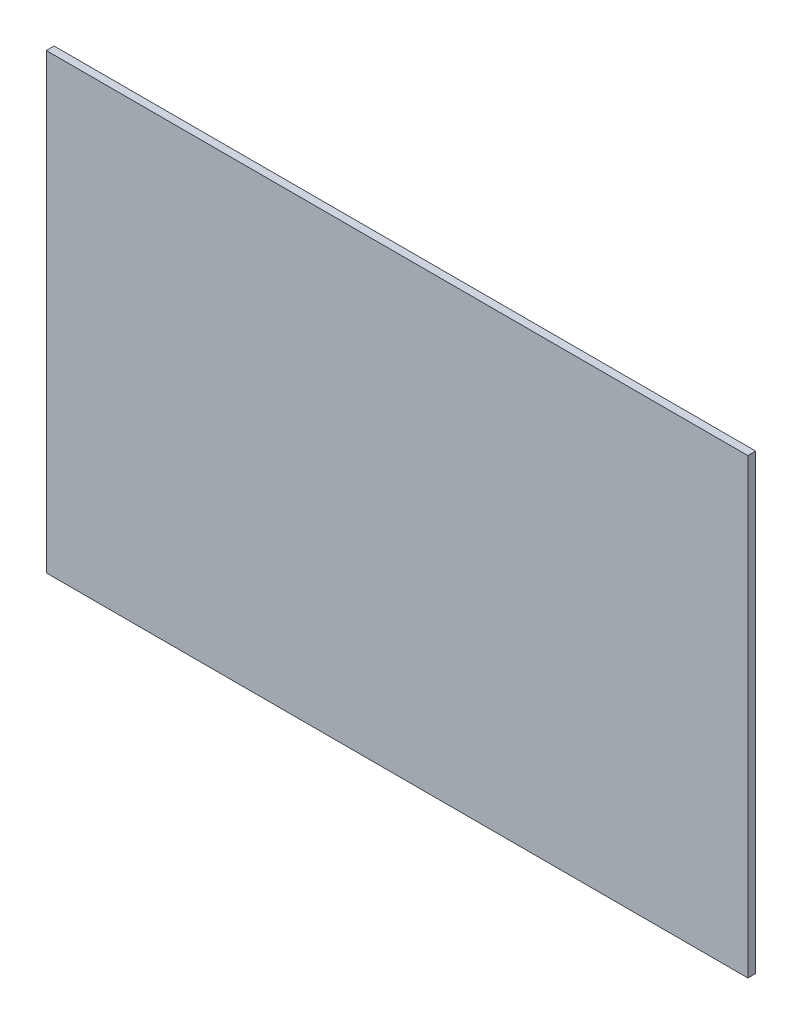
from build123d import *

# Parameters (mm, degrees)
SKETCH_1_W      = 537.999999999
SKETCH_1_H      = 346.9
EXTRUDE_1_DEPTH = 6


with BuildPart() as part:
    # Эскиз1 → Бобышка-Вытянуть1 (new body)
    with BuildSketch(Plane.XY):
        with Locations((-98.472703647, 18.479785592)):
            Rectangle(SKETCH_1_W, SKETCH_1_H)
    extrude(amount=EXTRUDE_1_DEPTH)


solid = part.part
